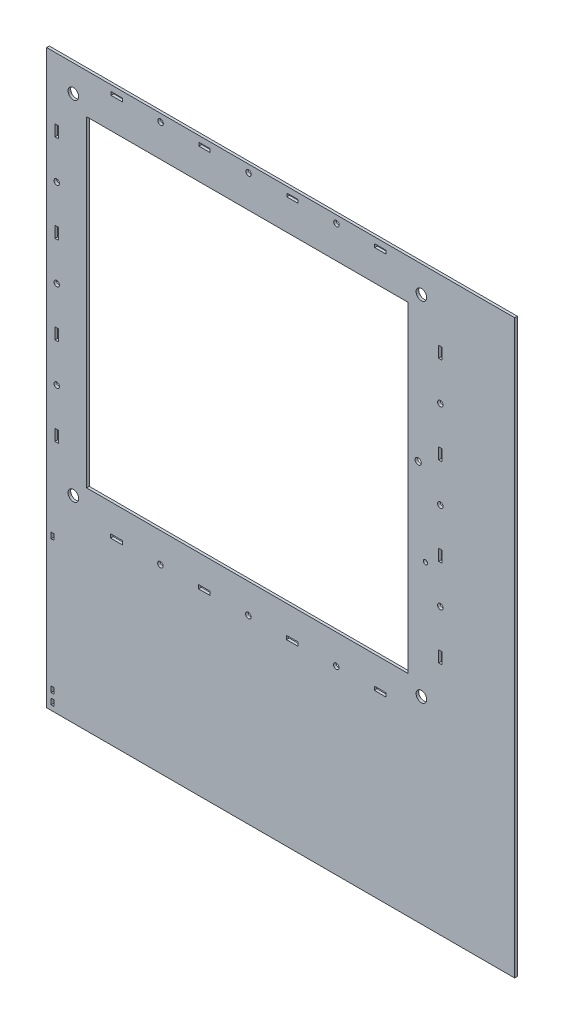
from build123d import *

# Parameters (mm, degrees)
SKETCH_1_R      = 2.05
SKETCH_1_R_2    = 4
SKETCH_1_R_3    = 2.332988974
SKETCH_1_R_4    = 1.601067765
SKETCH_1_W      = 8.8
SKETCH_1_H      = 2.8
SKETCH_1_W_2    = 2.5
SKETCH_1_H_2    = 8.5
SKETCH_1_W_3    = 8.5
SKETCH_1_H_3    = 2.5
SKETCH_1_W_4    = 241.301375666
SKETCH_1_H_4    = 241.301375666
SKETCH_1_W_5    = 2.3
SKETCH_1_H_5    = 4.3
EXTRUDE_1_DEPTH = 2


with BuildPart() as part:
    # 草图1 → 凸台-拉伸1 (new body)
    with BuildSketch(Plane.XY):
        Polygon((-150.650687833, -150.650687833), (-150.650687833, 150.650687833), (150.650687833, 150.650687833), (200.650687833, 150.650687833), (200.650687833, -278.650687833), (150.650687833, -278.650687833), (-150.650687833, -278.650687833), align=None)
        with Locations((0.724285714, -142.895)):
            Circle(SKETCH_1_R, mode=Mode.SUBTRACT)
        with Locations((66.724285714, -142.895)):
            Circle(SKETCH_1_R, mode=Mode.SUBTRACT)
        with Locations((-65.275714286, -142.895)):
            Circle(SKETCH_1_R, mode=Mode.SUBTRACT)
        with Locations((-143.125714286, 66.955)):
            Circle(SKETCH_1_R, mode=Mode.SUBTRACT)
        with Locations((-143.125714286, 0.955)):
            Circle(SKETCH_1_R, mode=Mode.SUBTRACT)
        with Locations((-143.125714286, -65.045)):
            Circle(SKETCH_1_R, mode=Mode.SUBTRACT)
        with Locations((66.874285714, 144.955)):
            Circle(SKETCH_1_R, mode=Mode.SUBTRACT)
        with Locations((0.874285714, 144.955)):
            Circle(SKETCH_1_R, mode=Mode.SUBTRACT)
        with Locations((-65.125714286, 144.955)):
            Circle(SKETCH_1_R, mode=Mode.SUBTRACT)
        with Locations((144.874285714, -65.045)):
            Circle(SKETCH_1_R, mode=Mode.SUBTRACT)
        with Locations((144.874285714, 0.955)):
            Circle(SKETCH_1_R, mode=Mode.SUBTRACT)
        with Locations((144.874285714, 66.955)):
            Circle(SKETCH_1_R, mode=Mode.SUBTRACT)
        with Locations((-130.650687833, -130.650687833)):
            Circle(SKETCH_1_R_2, mode=Mode.SUBTRACT)
        with Locations((-130.650687833, 130.650687833)):
            Circle(SKETCH_1_R_2, mode=Mode.SUBTRACT)
        with Locations((130.650687833, 130.650687833)):
            Circle(SKETCH_1_R_2, mode=Mode.SUBTRACT)
        with Locations((130.650687833, -130.650687833)):
            Circle(SKETCH_1_R_2, mode=Mode.SUBTRACT)
        with Locations((128.234921063, 21.045946403)):
            Circle(SKETCH_1_R_3, mode=Mode.SUBTRACT)
        with Locations((133.709191973, -41.76906745)):
            Circle(SKETCH_1_R_4, mode=Mode.SUBTRACT)
        with Locations((99.724285714, -142.895)):
            Rectangle(SKETCH_1_W, SKETCH_1_H, mode=Mode.SUBTRACT)
        with Locations((33.724285714, -142.895)):
            Rectangle(SKETCH_1_W, SKETCH_1_H, mode=Mode.SUBTRACT)
        with Locations((-32.275714286, -142.895)):
            Rectangle(SKETCH_1_W, SKETCH_1_H, mode=Mode.SUBTRACT)
        with Locations((-98.275714286, -142.895)):
            Rectangle(SKETCH_1_W, SKETCH_1_H, mode=Mode.SUBTRACT)
        with Locations((-143.125714286, 99.955)):
            Rectangle(SKETCH_1_W_2, SKETCH_1_H_2, mode=Mode.SUBTRACT)
        with Locations((-143.125714286, 33.955)):
            Rectangle(SKETCH_1_W_2, SKETCH_1_H_2, mode=Mode.SUBTRACT)
        with Locations((-143.125714286, -32.045)):
            Rectangle(SKETCH_1_W_2, SKETCH_1_H_2, mode=Mode.SUBTRACT)
        with Locations((-143.125714286, -98.045)):
            Rectangle(SKETCH_1_W_2, SKETCH_1_H_2, mode=Mode.SUBTRACT)
        with Locations((99.874285714, 144.955)):
            Rectangle(SKETCH_1_W_3, SKETCH_1_H_3, mode=Mode.SUBTRACT)
        with Locations((33.874285714, 144.955)):
            Rectangle(SKETCH_1_W_3, SKETCH_1_H_3, mode=Mode.SUBTRACT)
        with Locations((-32.125714286, 144.955)):
            Rectangle(SKETCH_1_W_3, SKETCH_1_H_3, mode=Mode.SUBTRACT)
        with Locations((-98.125714286, 144.955)):
            Rectangle(SKETCH_1_W_3, SKETCH_1_H_3, mode=Mode.SUBTRACT)
        with Locations((144.874285714, -98.045)):
            Rectangle(SKETCH_1_W_2, SKETCH_1_H_2, mode=Mode.SUBTRACT)
        with Locations((144.874285714, -32.045)):
            Rectangle(SKETCH_1_W_2, SKETCH_1_H_2, mode=Mode.SUBTRACT)
        with Locations((144.874285714, 33.955)):
            Rectangle(SKETCH_1_W_2, SKETCH_1_H_2, mode=Mode.SUBTRACT)
        with Locations((144.874285714, 99.955)):
            Rectangle(SKETCH_1_W_2, SKETCH_1_H_2, mode=Mode.SUBTRACT)
        Rectangle(SKETCH_1_W_4, SKETCH_1_H_4, mode=Mode.SUBTRACT)
        with Locations((-146.175714286, -272.895)):
            Rectangle(SKETCH_1_W_5, SKETCH_1_H_5, mode=Mode.SUBTRACT)
        with Locations((-146.175714286, -264.895)):
            Rectangle(SKETCH_1_W_5, SKETCH_1_H_5, mode=Mode.SUBTRACT)
        with Locations((-146.175714286, -164.895)):
            Rectangle(SKETCH_1_W_5, SKETCH_1_H_5, mode=Mode.SUBTRACT)
    extrude(amount=EXTRUDE_1_DEPTH)


solid = part.part
